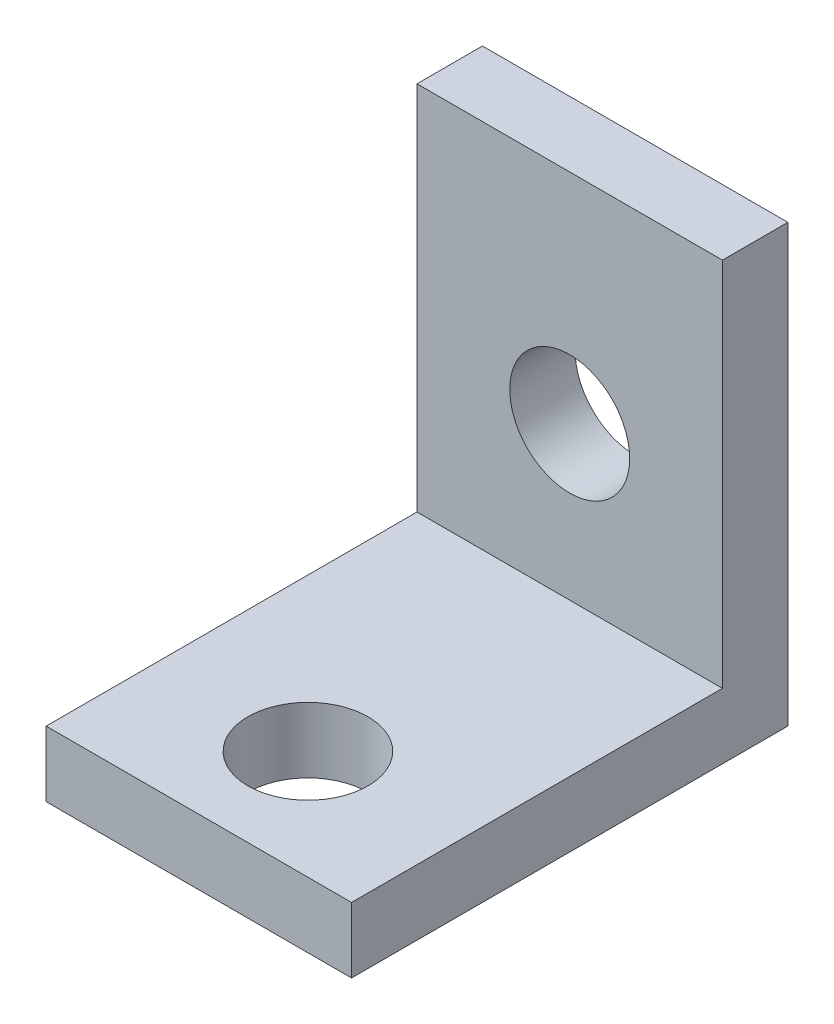
from build123d import *

# Parameters (mm, degrees)
BOSS_EXTRUDE1_DEPTH      = 7
BOSS_EXTRUDE1_DEPTH_BACK = 7
SKETCH2_R                = 2.75
CUT_EXTRUDE1_DEPTH       = 3
SKETCH3_R                = 2.75
CUT_EXTRUDE2_DEPTH       = 3


with BuildPart() as part:
    # Sketch1 → Boss-Extrude1 (new, two sides: drawn at the far end of the back side and taken through both)
    with BuildSketch(Plane(origin=(0, 0, 0), x_dir=(0, 0, -1), z_dir=(1, 0, 0)).offset(-BOSS_EXTRUDE1_DEPTH_BACK)):
        Polygon((-20, 0), (0, 0), (0, 20), (-3, 20), (-3, 3), (-20, 3), align=None)
    extrude(amount=BOSS_EXTRUDE1_DEPTH + BOSS_EXTRUDE1_DEPTH_BACK)

    # Sketch2 → Cut-Extrude1 (cut)
    with BuildSketch(Plane.XY):
        with Locations((0, 10)):
            Circle(SKETCH2_R)
    extrude(amount=CUT_EXTRUDE1_DEPTH, mode=Mode.SUBTRACT)

    # Sketch3 → Cut-Extrude2 (cut)
    with BuildSketch(Plane(origin=(0, 0, 0), x_dir=(1, 0, 0), z_dir=(0, 1, 0))):
        with Locations((0, -15)):
            Circle(SKETCH3_R)
    extrude(amount=CUT_EXTRUDE2_DEPTH, mode=Mode.SUBTRACT)


solid = part.part
